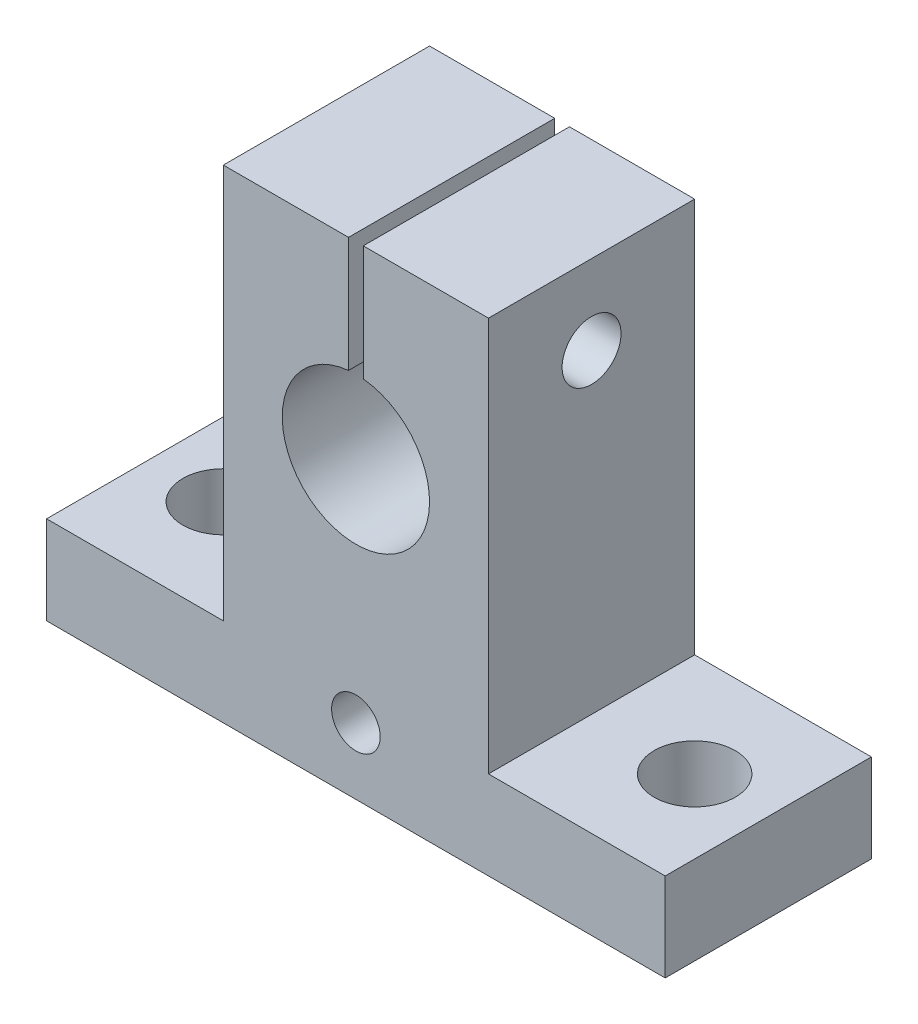
from build123d import *

# Parameters (mm, degrees)
SKETCH_3_R          = 5
EXTRUDE_3_DEPTH     = 7
SKETCH_5_R          = 2.75
CUT_EXTRUDE_1_DEPTH = 10
SKETCH_6_W          = 1
SKETCH_6_H          = 13.139857665
CUT_EXTRUDE_2_DEPTH = 14
SKETCH_7_R          = 2
CUT_EXTRUDE_3_DEPTH = 37.405494091
HOLE_WIZARD_M4_1_D  = 3.3


with BuildPart() as part:
    # 草图3 → 凸台-拉伸3 (new, symmetric)
    with BuildSketch(Plane.XY):
        Polygon((-9, -13.4), (-21, -13.4), (-21, -19.4), (21, -19.4), (21, -13.4), (9, -13.4), (9, 13.4), (-9, 13.4), align=None)
        with Locations((0, 0.6)):
            Circle(SKETCH_3_R, mode=Mode.SUBTRACT)
    extrude(amount=EXTRUDE_3_DEPTH, both=True)

    # 草图5 → 切除-拉伸1 (cut)
    with BuildSketch(Plane(origin=(0, -13.4, 0), x_dir=(1, 0, 0), z_dir=(0, 1, 0))):
        with Locations(Location((-16, 0, 0), (0, 0, 270))):
            Circle(SKETCH_5_R)
        with Locations(Location((16, 0, 0), (0, 0, 180))):
            Circle(SKETCH_5_R)
    extrude(amount=-CUT_EXTRUDE_1_DEPTH, mode=Mode.SUBTRACT)

    # 草图6 → 切除-拉伸2 (cut)
    with BuildSketch(Plane.XY.offset(7)):
        with Locations((0, 10.029998353)):
            Rectangle(SKETCH_6_W, SKETCH_6_H)
    extrude(amount=-CUT_EXTRUDE_2_DEPTH, mode=Mode.SUBTRACT)

    # 草图7 → 切除-拉伸3 (cut, through all)
    with BuildSketch(Plane(origin=(9, 0, 0), x_dir=(0, 0, -1), z_dir=(1, 0, 0))):
        with Locations(Location((0, 8, 0), (0, 0, 90))):
            Circle(SKETCH_7_R)
    extrude(amount=-CUT_EXTRUDE_3_DEPTH, mode=Mode.SUBTRACT)

    # M4 螺纹孔1 (through all)
    with Locations(Plane.XY.offset(7)):
        with Locations((0, -14.9)):
            Hole(HOLE_WIZARD_M4_1_D / 2)


solid = part.part
